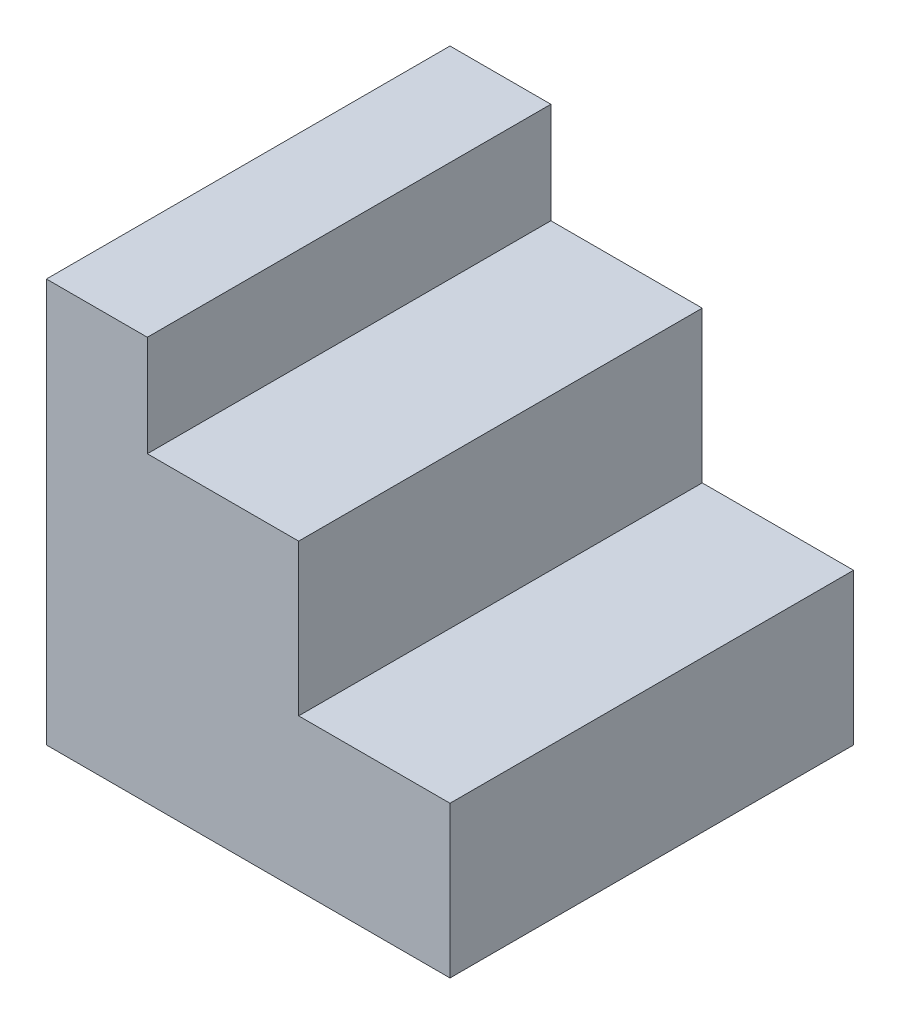
from build123d import *

# Parameters (mm, degrees)
BOSS_EXTRUDE1_DEPTH = 40


with BuildPart() as part:
    # Sketch1 → Boss-Extrude1 (new body)
    with BuildSketch(Plane.XY):
        Polygon((-20, -7.5), (20, -7.5), (20, 7.5), (5, 7.5), (5, 22.5), (-10, 22.5), (-10, 32.5), (-20, 32.5), (-20, 22.5), (-20, 7.5), align=None)
    extrude(amount=BOSS_EXTRUDE1_DEPTH)


solid = part.part
